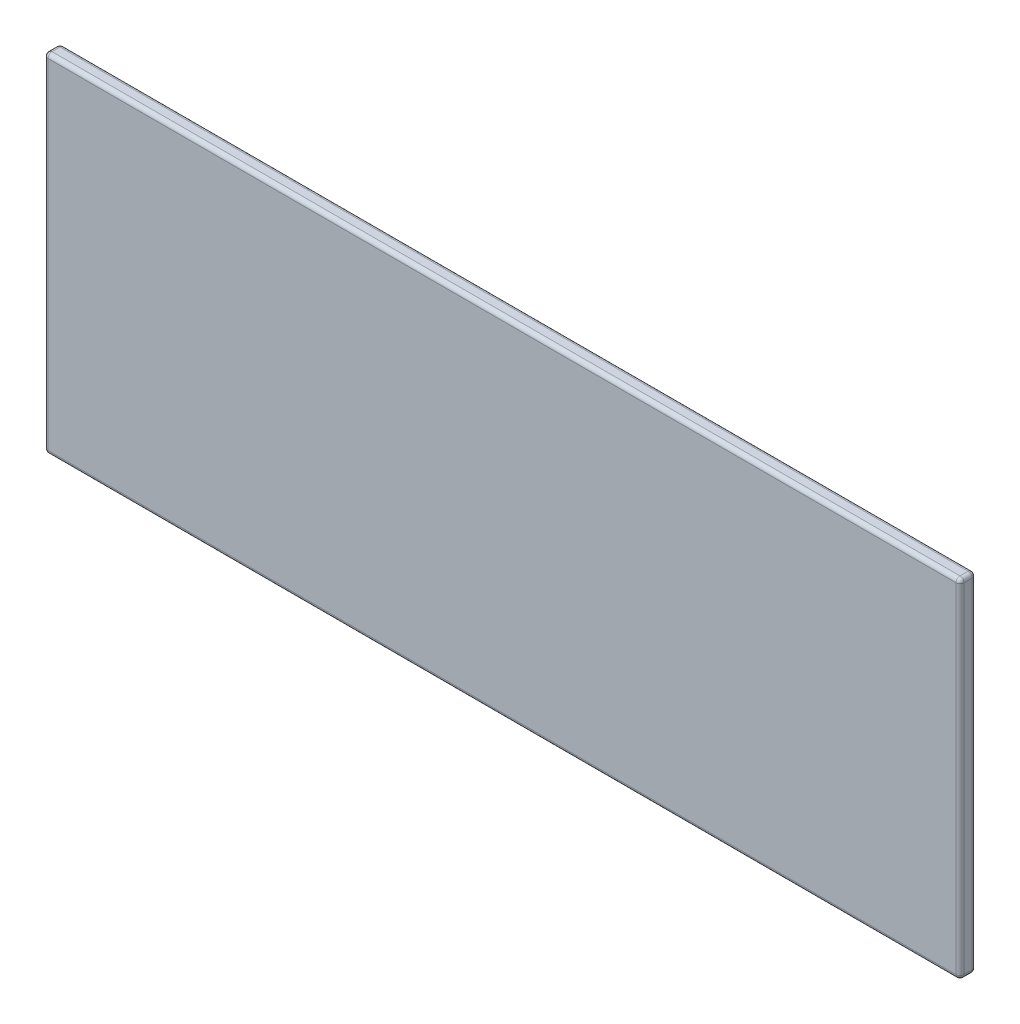
from build123d import *

# Parameters (mm, degrees)
SKETCH1_W           = 114.7
SKETCH1_H           = 43.5
BOSS_EXTRUDE1_DEPTH = 2
FILLET1_R           = 0.5


with BuildPart() as part:
    # Sketch1 → Boss-Extrude1 (new body)
    with BuildSketch(Plane.XY):
        Rectangle(SKETCH1_W, SKETCH1_H)
    extrude(amount=BOSS_EXTRUDE1_DEPTH)

    # Fillet1
    fillet1_edges = [part.edges().sort_by_distance(p)[0] for p in [
        (-57.35, 0, 2),
        (0, -21.75, 2),
        (57.35, 0, 2),
        (0, -21.75, 0),
        (-57.35, 0, 0),
        (0, 21.75, 0),
        (57.35, 0, 0),
        (57.35, -21.75, 1),
        (-57.35, -21.75, 1),
        (-57.35, 21.75, 1),
        (57.35, 21.75, 1),
        (0, 21.75, 2),
    ]]
    fillet(fillet1_edges, radius=FILLET1_R)


solid = part.part
